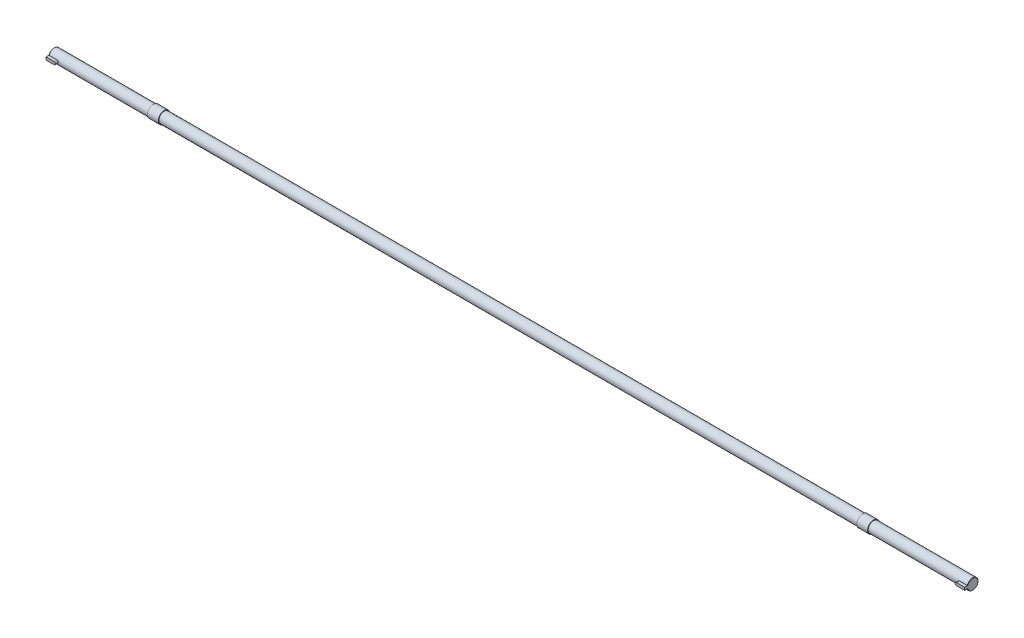
from build123d import *

# Parameters (mm, degrees)
CHAMFER1_SIZE            = 1
BOSS_EXTRUDE2_DEPTH      = 10
BOSS_EXTRUDE2_DEPTH_BACK = 5


with BuildPart() as part:
    # Sketch1 → Revolve1 (revolve)
    with BuildSketch(Plane.XY):
        Polygon((-1695, 0), (1695, 0), (1695, -20), (1328.75, -20), (1328.75, -22), (1288.75, -22), (1288.75, -20), (-1288.75, -20), (-1288.75, -22), (-1328.75, -22), (-1328.75, -20), (-1695, -20), align=None)
    revolve(axis=Axis((-1695, 0, 0), (1, 0, 0)))

    # Chamfer1
    chamfer1_edges = [part.edges().sort_by_distance(p)[0] for p in [
        (1695, 20, 0),
        (-1695, 20, 0),
    ]]
    chamfer(chamfer1_edges, length=CHAMFER1_SIZE)

    # Sketch3 → Boss-Extrude2 (add, two sides: drawn at the far end of the back side and taken through both)
    with BuildSketch(Plane.XY.offset(20).offset(-BOSS_EXTRUDE2_DEPTH_BACK)):
        with BuildLine():
            Line((1665, 5), (1695, 5))
            Line((1695, 5), (1695, -5))
            Line((1695, -5), (1665, -5))
            ThreePointArc((1665, -5), (1660, 0), (1665, 5))
        make_face()
        with BuildLine():
            Line((-1695, 5), (-1695, -5))
            Line((-1695, -5), (-1665, -5))
            ThreePointArc((-1665, -5), (-1660, 0), (-1665, 5))
            Line((-1665, 5), (-1695, 5))
        make_face()
    extrude(amount=BOSS_EXTRUDE2_DEPTH + BOSS_EXTRUDE2_DEPTH_BACK)


solid = part.part
